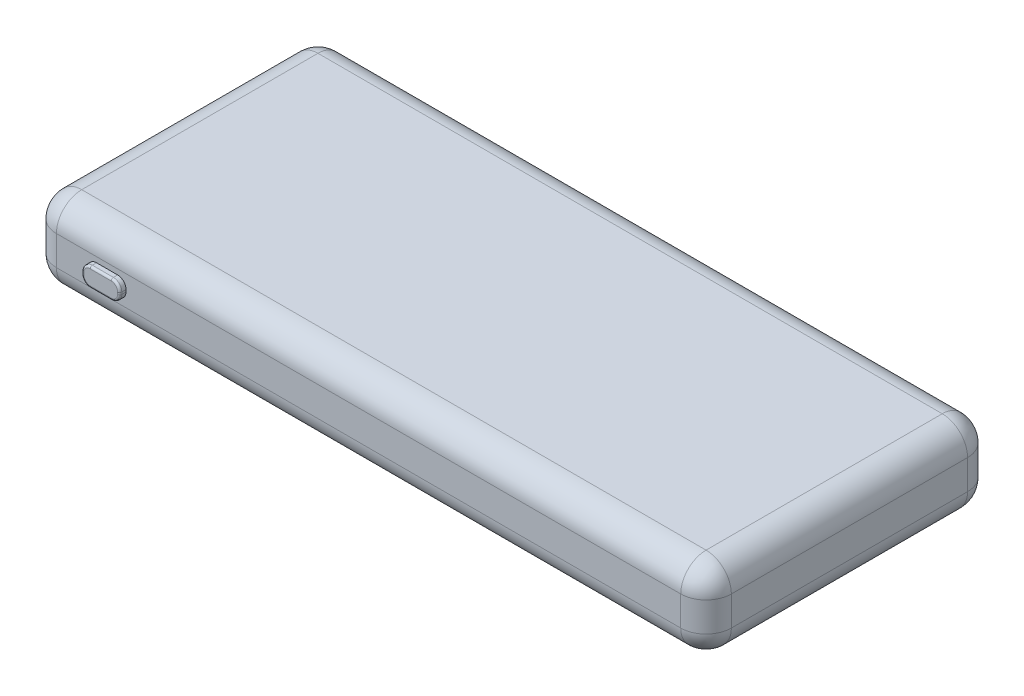
from build123d import *
from OCP.BRepFilletAPI import BRepFilletAPI_MakeFillet

# Parameters (mm, degrees)
SKETCH1_W           = 160
SKETCH1_H           = 68
BOSS_EXTRUDE1_DEPTH = 19
FILLET1_R           = 6
SKETCH2_W           = 9
SKETCH2_H           = 4.5
BOSS_EXTRUDE2_DEPTH = 1.5
FILLET2_R1          = 2
FILLET2_R2          = 0.5


with BuildPart() as part:
    # Sketch1 → Boss-Extrude1 (new body)
    with BuildSketch(Plane(origin=(0, 0, 0), x_dir=(1, 0, 0), z_dir=(0, 1, 0))):
        Rectangle(SKETCH1_W, SKETCH1_H)
    extrude(amount=BOSS_EXTRUDE1_DEPTH)

    # Fillet1
    fillet1_edges = [part.edges().sort_by_distance(p)[0] for p in [
        (-80, 19, 0),
        (0, 19, 34),
        (80, 19, 0),
        (0, 0, 34),
        (-80, 0, 0),
        (0, 0, -34),
        (80, 0, 0),
        (80, 9.5, 34),
        (-80, 9.5, 34),
        (-80, 9.5, -34),
        (80, 9.5, -34),
        (0, 19, -34),
    ]]
    fillet(fillet1_edges, radius=FILLET1_R)

    # Sketch2 → Boss-Extrude2 (add)
    with BuildSketch(Plane.XY.offset(34)):
        with Locations((-62, 9.5)):
            Rectangle(SKETCH2_W, SKETCH2_H)
    extrude(amount=BOSS_EXTRUDE2_DEPTH)

    # Fillet2: one fillet with a radius per group of edges: ONE call of the kernel's fillet builder (fillet() takes one radius for all edges)
    fillet2_edges_1 = [part.edges().sort_by_distance(p)[0] for p in [
        (-57.5, 7.25, 34.75),
        (-57.5, 11.75, 34.75),
        (-66.5, 11.75, 34.75),
        (-66.5, 7.25, 34.75),
    ]]
    fillet2_edges_2 = [part.edges().sort_by_distance(p)[0] for p in [
        (-57.5, 9.5, 35.5),
        (-62, 11.75, 35.5),
        (-66.5, 9.5, 35.5),
        (-62, 7.25, 35.5),
    ]]
    fillet2 = BRepFilletAPI_MakeFillet(part.part.solid().wrapped)
    for e in fillet2_edges_1:
        fillet2.Add(FILLET2_R1, e.wrapped)
    for e in fillet2_edges_2:
        fillet2.Add(FILLET2_R2, e.wrapped)
    add(Compound.cast(fillet2.Shape()), mode=Mode.REPLACE)


solid = part.part
